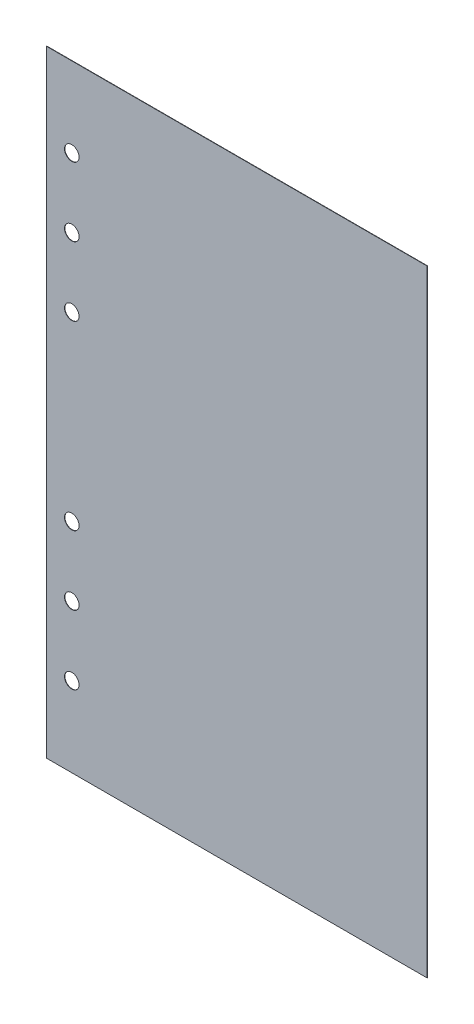
from build123d import *

# Parameters (mm, degrees)
SKETCH_1_W      = 105
SKETCH_1_H      = 170
SKETCH_1_R      = 2
EXTRUDE_1_DEPTH = 0.1


with BuildPart() as part:
    # Эскиз1 → Бобышка-Вытянуть1 (new body)
    with BuildSketch(Plane.XY):
        with Locations((52.5, 85)):
            Rectangle(SKETCH_1_W, SKETCH_1_H)
        with Locations((7, 110)):
            Circle(SKETCH_1_R, mode=Mode.SUBTRACT)
        with Locations((7, 129)):
            Circle(SKETCH_1_R, mode=Mode.SUBTRACT)
        with Locations((7, 148)):
            Circle(SKETCH_1_R, mode=Mode.SUBTRACT)
        with Locations(Location((7, 22, 0), (0, 0, 180))):
            Circle(SKETCH_1_R, mode=Mode.SUBTRACT)
        with Locations(Location((7, 41, 0), (0, 0, 180))):
            Circle(SKETCH_1_R, mode=Mode.SUBTRACT)
        with Locations(Location((7, 60, 0), (0, 0, 180))):
            Circle(SKETCH_1_R, mode=Mode.SUBTRACT)
    extrude(amount=EXTRUDE_1_DEPTH)


solid = part.part
